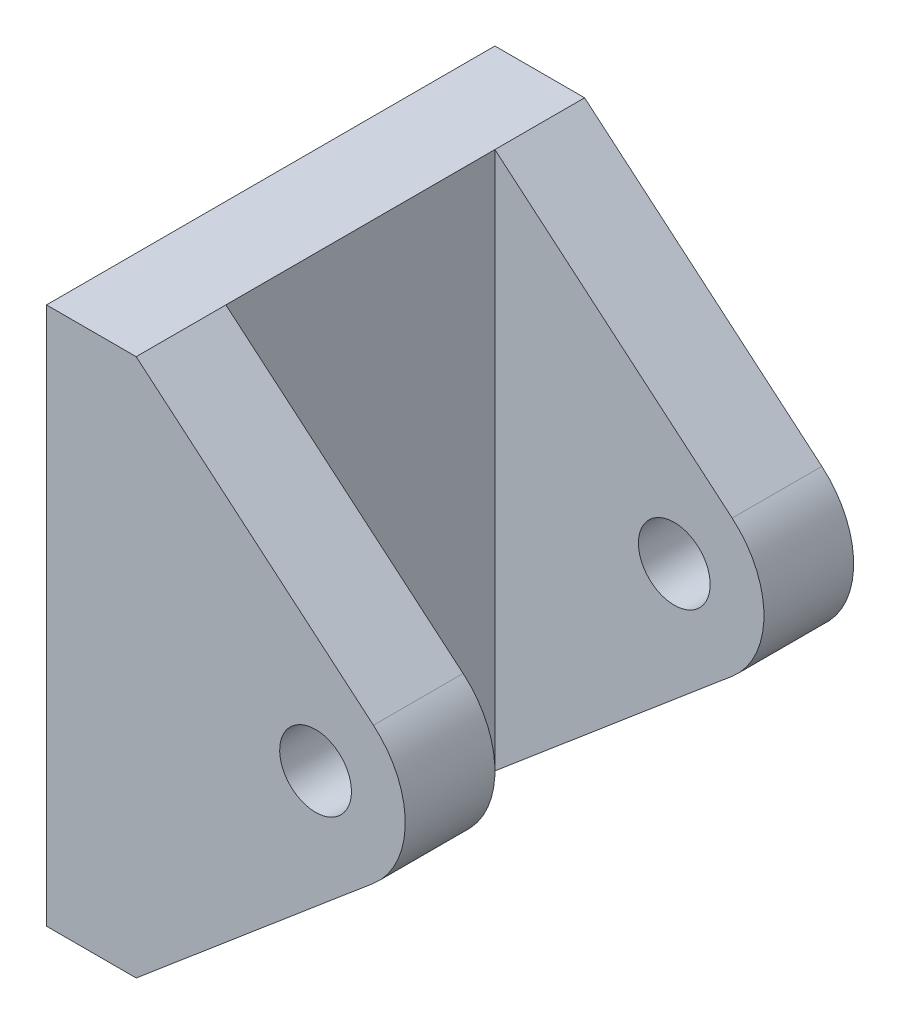
from build123d import *

# Parameters (mm, degrees)
SKETCH1_R               = 4
BOSS_EXTRUDE1_DEPTH     = 50
CUT_EXTRUDE1_DEPTH      = 40
CUT_EXTRUDE1_DEPTH_BACK = 20
SKETCH2_W               = 30
SKETCH2_H               = 60


with BuildPart() as part:
    # Sketch1 → Boss-Extrude1 (new body)
    with BuildSketch(Plane.XY):
        with BuildLine():
            ThreePointArc((6.455619112, -7.637079408), (10, 0), (6.455619112, 7.637079408))
            Line((6.455619112, 7.637079408), (-20, 30))
            Line((-20, 30), (-30, 30))
            Line((-30, 30), (-30, -30))
            Line((-30, -30), (-20, -30))
            Line((-20, -30), (6.455619112, -7.637079408))
        make_face()
        Circle(SKETCH1_R, mode=Mode.SUBTRACT)
    extrude(amount=BOSS_EXTRUDE1_DEPTH)

    # Sketch2 → Cut-Extrude1 (cut, two sides: drawn at the far end of the back side and taken through both)
    with BuildSketch(Plane(origin=(0, 0, 0), x_dir=(0, 0, -1), z_dir=(1, 0, 0)).offset(-CUT_EXTRUDE1_DEPTH_BACK)):
        with Locations((-25, 0)):
            Rectangle(SKETCH2_W, SKETCH2_H)
    extrude(amount=CUT_EXTRUDE1_DEPTH + CUT_EXTRUDE1_DEPTH_BACK, mode=Mode.SUBTRACT)


solid = part.part
